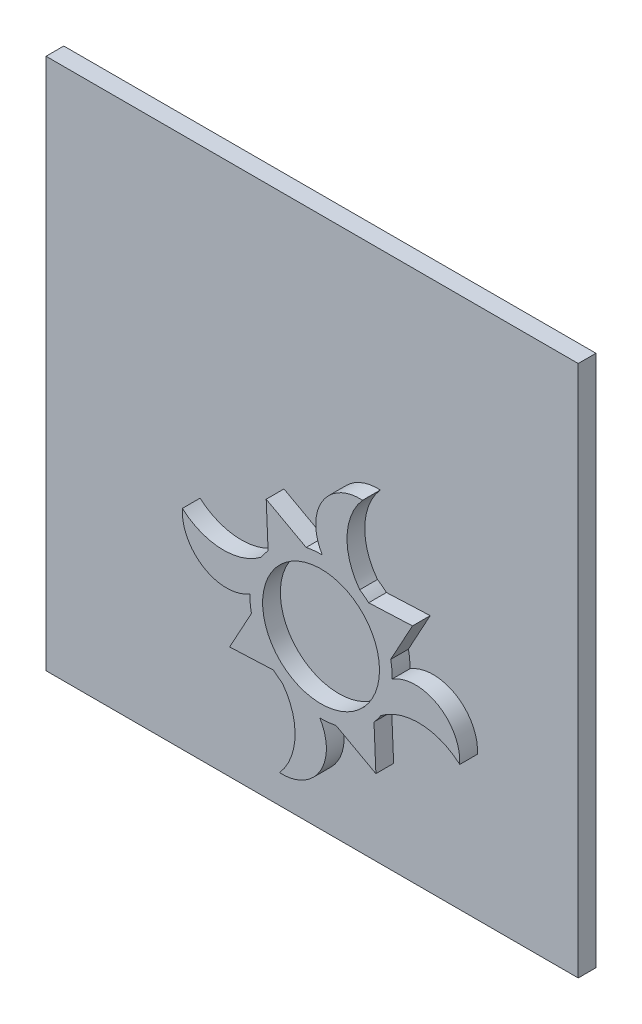
from build123d import *

# Parameters (mm, degrees)
SKICA1_W                = 300
SKICA1_H                = 300
P_IDAT_VYSUNUT_M1_DEPTH = 10
SKICA3_R                = 40.135302542
SKICA3_R_2              = 32.941200184
P_IDAT_VYSUNUT_M3_DEPTH = 10


with BuildPart() as part:
    # Skica1 → Přidat vysunutím1 (new body)
    with BuildSketch(Plane.XY):
        with Locations((150, 150)):
            Rectangle(SKICA1_W, SKICA1_H)
    extrude(amount=P_IDAT_VYSUNUT_M1_DEPTH)

    # Skica3 → Přidat vysunutím3 (add)
    # profile 1 of 9: a face of its own
    with BuildSketch(Plane.XY.offset(10)):
        with Locations((165.026842843, 104.272964979)):
            Circle(SKICA3_R)
        with Locations((165.026842843, 104.272964979)):
            Circle(SKICA3_R_2, mode=Mode.SUBTRACT)
    # profile 2 of 9: a face of its own
    with BuildSketch(Plane.XY.offset(10)):
        with BuildLine():
            Line((134.114323402, 155.810428325), (135.178982609, 131.104807063))
            ThreePointArc((135.178982609, 131.104807063), (144.916831788, 139.006665697), (156.618002898, 143.517504994))
            Line((156.618002898, 143.517504994), (134.114323402, 155.810428325))
        make_face()
    # profile 3 of 9: a face of its own
    with BuildSketch(Plane.XY.offset(10)):
        with BuildLine():
            ThreePointArc((188.438271645, 182.463164069), (165.555400469, 170.31094498), (165.733072295, 144.402053558))
            ThreePointArc((165.733072295, 144.402053558), (176.734461574, 142.662731504), (186.834212062, 137.966898527))
            ThreePointArc((186.834212062, 137.966898527), (179.680788671, 160.50181988), (188.438271645, 182.463164069))
        make_face()
    # profile 4 of 9: a face of its own
    with BuildSketch(Plane.XY.offset(10)):
        with BuildLine():
            Line((216.564306188, 135.185484421), (191.858684926, 134.120825214))
            ThreePointArc((191.858684926, 134.120825214), (199.76054356, 124.382976034), (204.271382857, 112.681804924))
            Line((204.271382857, 112.681804924), (216.564306188, 135.185484421))
        make_face()
    # profile 5 of 9: a face of its own
    with BuildSketch(Plane.XY.offset(10)):
        with BuildLine():
            ThreePointArc((243.217041932, 80.861536177), (231.064822844, 103.744407353), (205.155931421, 103.566735527))
            ThreePointArc((205.155931421, 103.566735527), (203.416609367, 92.565346248), (198.72077639, 82.46559576))
            ThreePointArc((198.72077639, 82.46559576), (221.255697743, 89.619019151), (243.217041932, 80.861536177))
        make_face()
    # profile 6 of 9: a face of its own
    with BuildSketch(Plane.XY.offset(10)):
        with BuildLine():
            ThreePointArc((194.874703077, 77.441122896), (185.136853898, 69.539264262), (173.435682787, 65.028424965))
            Line((173.435682787, 65.028424965), (195.939362284, 52.735501634))
            Line((195.939362284, 52.735501634), (194.874703077, 77.441122896))
        make_face()
    # profile 7 of 9: a face of its own
    with BuildSketch(Plane.XY.offset(10)):
        with BuildLine():
            ThreePointArc((164.32061339, 64.143876401), (153.319224112, 65.883198455), (143.219473624, 70.579031432))
            ThreePointArc((143.219473624, 70.579031432), (150.372897014, 48.044110079), (141.615414041, 26.08276589))
            ThreePointArc((141.615414041, 26.08276589), (164.498285217, 38.234984979), (164.32061339, 64.143876401))
        make_face()
    # profile 8 of 9: a face of its own
    with BuildSketch(Plane.XY.offset(10)):
        with BuildLine():
            ThreePointArc((138.195000759, 74.425104745), (130.293142125, 84.162953925), (125.782302829, 95.864125035))
            Line((125.782302829, 95.864125035), (113.489379497, 73.360445538))
            Line((113.489379497, 73.360445538), (138.195000759, 74.425104745))
        make_face()
    # profile 9 of 9: a face of its own
    with BuildSketch(Plane.XY.offset(10)):
        with BuildLine():
            ThreePointArc((124.897754265, 104.979194432), (126.637076319, 115.980583711), (131.332909296, 126.080334199))
            ThreePointArc((131.332909296, 126.080334199), (108.797987942, 118.926910808), (86.836643754, 127.684393782))
            ThreePointArc((86.836643754, 127.684393782), (98.988862842, 104.801522606), (124.897754265, 104.979194432))
        make_face()
    extrude(amount=P_IDAT_VYSUNUT_M3_DEPTH)


solid = part.part
